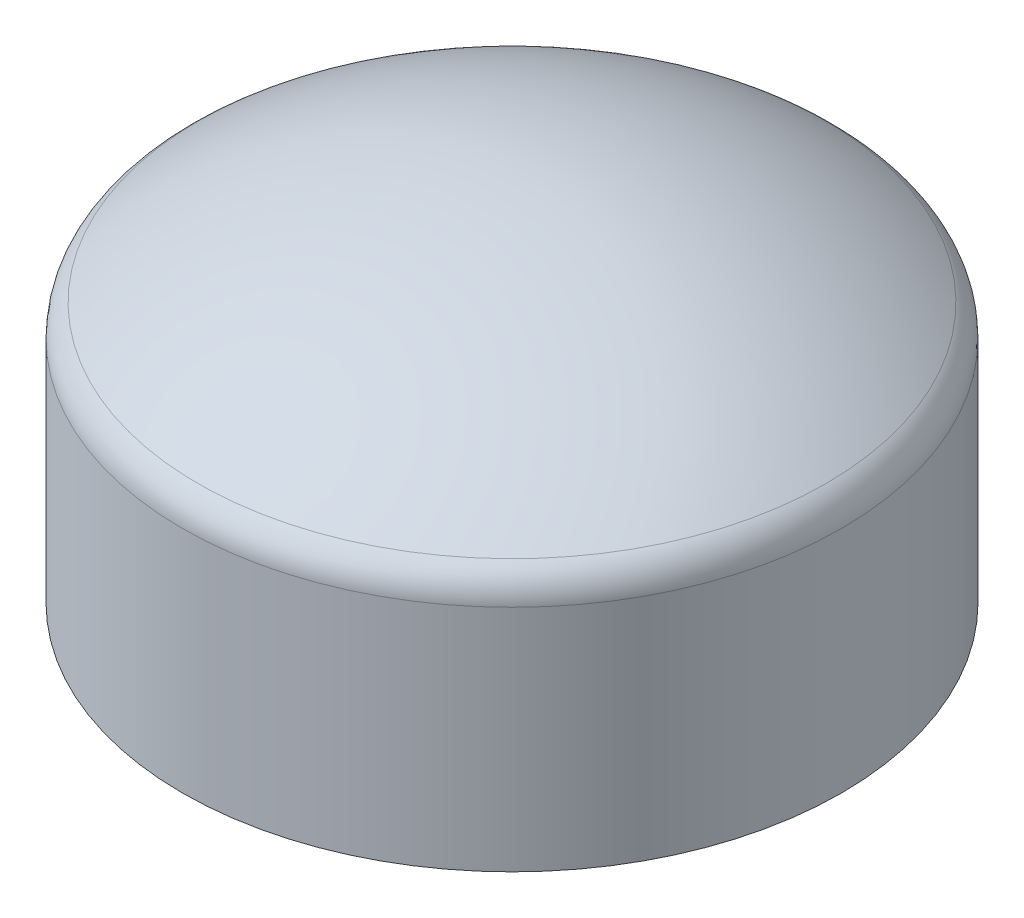
from build123d import *

# Parameters (mm, degrees)
FILLET1_R = 1


with BuildPart() as part:
    # Sketch1 → Revolve1 (revolve)
    with BuildSketch(Plane.XY, mode=Mode.PRIVATE) as revolve1_sk:
        with BuildLine():
            Line((-6.5, 0), (-8.5, 0))
            Line((-8.5, 0), (-8.5, 6.4))
            ThreePointArc((-8.5, 6.4), (-4.506939094, 8.627994101), (0, 9.4))
            Line((0, 9.4), (0, 5.4))
            Line((0, 5.4), (-6.5, 5.4))
            Line((-6.5, 5.4), (-6.5, 0))
        make_face()
    revolve(revolve1_sk.sketch.rotate(Axis((0, 5.4, 0), (0, 1, 0)), 180), axis=Axis((0, 5.4, 0), (0, 1, 0)))

    # Fillet1
    fillet1_edges = [part.edges().sort_by_distance(p)[0] for p in [
        (-8.5, 6.4, 0),
    ]]
    fillet(fillet1_edges, radius=FILLET1_R)


solid = part.part
